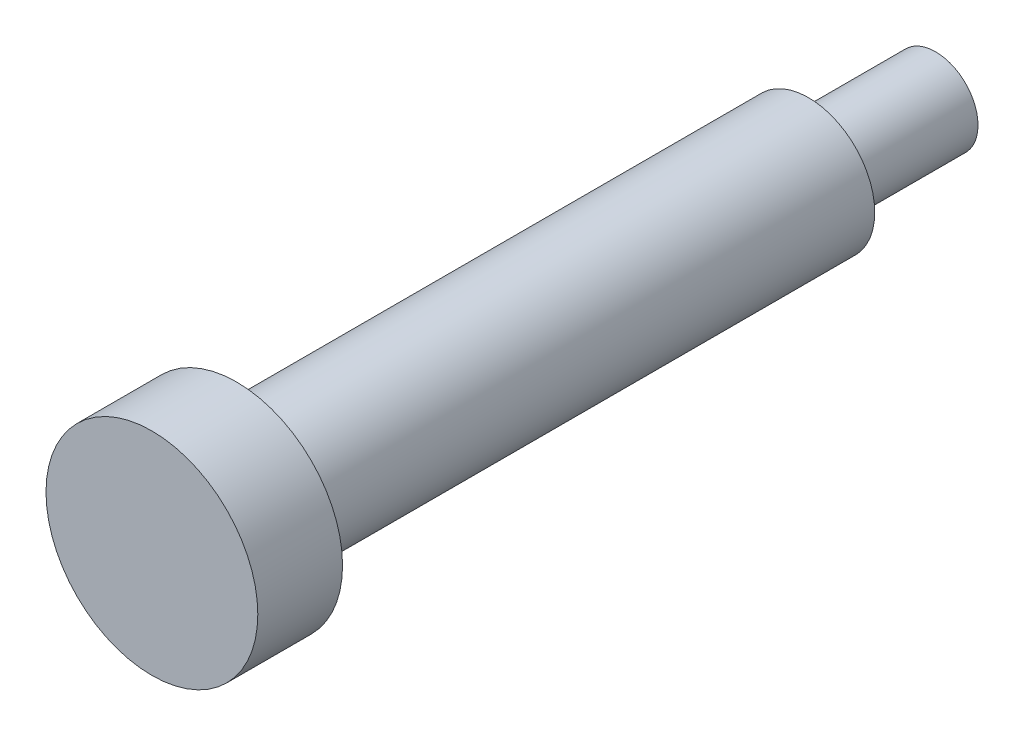
from build123d import *

# Parameters (mm, degrees)
SKETCH1_R           = 5
SKETCH1_R_2         = 3.125
SKETCH1_R_3         = 2
BOSS_EXTRUDE1_DEPTH = 4
SKETCH1_3_R         = 3.125
SKETCH1_3_R_2       = 2
BOSS_EXTRUDE2_DEPTH = 27
BOSS_EXTRUDE3_START = -27
SKETCH1_4_R         = 2
BOSS_EXTRUDE3_DEPTH = 6


with BuildPart() as part:
    # Sketch1 → Boss-Extrude1 (new body)
    # profile 1 of 3: a face of its own
    with BuildSketch(Plane.XY):
        Circle(SKETCH1_R)
        Circle(SKETCH1_R_2, mode=Mode.SUBTRACT)
    # profile 2 of 3: a face of its own
    with BuildSketch(Plane.XY):
        Circle(SKETCH1_R_2)
        Circle(SKETCH1_R_3, mode=Mode.SUBTRACT)
    # profile 3 of 3: a face of its own
    with BuildSketch(Plane.XY):
        Circle(SKETCH1_R_3)
    extrude(amount=BOSS_EXTRUDE1_DEPTH)

    # Sketch1<3> → Boss-Extrude2 (add)
    # profile 1 of 2: a face of its own
    with BuildSketch(Plane.XY):
        Circle(SKETCH1_3_R)
        Circle(SKETCH1_3_R_2, mode=Mode.SUBTRACT)
    # profile 2 of 2: a face of its own
    with BuildSketch(Plane.XY):
        Circle(SKETCH1_3_R_2)
    extrude(amount=-BOSS_EXTRUDE2_DEPTH)

    # Sketch1<4> → Boss-Extrude3 (add)
    with BuildSketch(Plane.XY.offset(BOSS_EXTRUDE3_START)):
        Circle(SKETCH1_4_R)
    extrude(amount=-BOSS_EXTRUDE3_DEPTH)


solid = part.part
